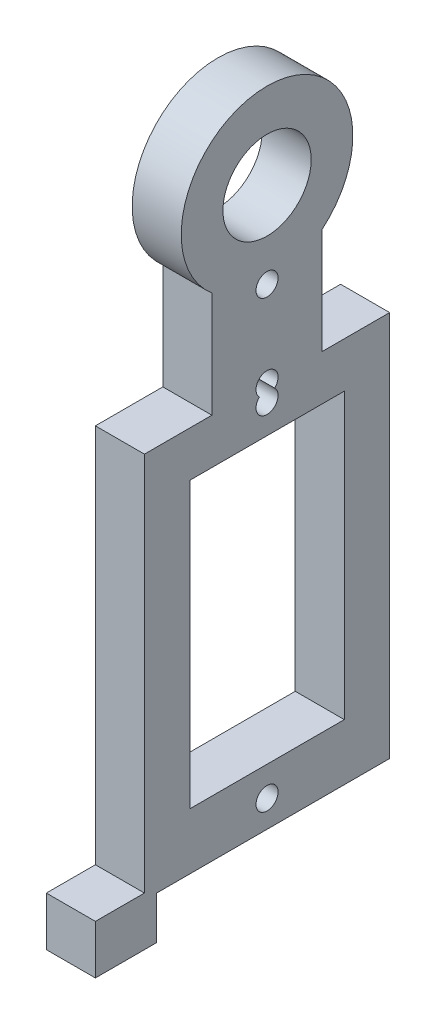
from build123d import *

# Parameters (mm, degrees)
SKETCH1_R            = 7
BOSS_EXTRUDE1_DEPTH  = 4
BOSS_EXTRUDE2_START  = -4.5
SKETCH2_W            = 4
SKETCH2_H            = 34
BOSS_EXTRUDE2_DEPTH  = 9
BOSS_EXTRUDE3_START  = -10
SKETCH3_W            = 4
SKETCH3_H            = 31.5
BOSS_EXTRUDE3_DEPTH  = 20
BOSS_EXTRUDE4_START  = 9
SKETCH4_W            = 4
SKETCH4_H            = 4
BOSS_EXTRUDE4_DEPTH  = 5
BOSS_EXTRUDE5_START  = -1
SKETCH5_R            = 3.6
BOSS_EXTRUDE5_DEPTH  = 6
BOSS_EXTRUDE6_START  = -1
SKETCH6_R            = 0.9
BOSS_EXTRUDE6_DEPTH  = 6
BOSS_EXTRUDE7_START  = -1
SKETCH7_R            = 0.9
BOSS_EXTRUDE7_DEPTH  = 6
BOSS_EXTRUDE8_START  = -6.3
SKETCH8_W            = 6
SKETCH8_H            = 23.2
BOSS_EXTRUDE8_DEPTH  = 12.6
BOSS_EXTRUDE9_START  = -1
SKETCH9_R            = 0.9
BOSS_EXTRUDE9_DEPTH  = 6
BOSS_EXTRUDE10_START = -1
SKETCH10_R           = 0.9
BOSS_EXTRUDE10_DEPTH = 6


with BuildPart() as part:
    # Sketch1 → Boss-Extrude1 (new body)
    with BuildSketch(Plane(origin=(0, 0, 0), x_dir=(0, 0, -1), z_dir=(1, 0, 0))):
        Circle(SKETCH1_R)
    extrude(amount=BOSS_EXTRUDE1_DEPTH)

    # Sketch2 → Boss-Extrude2 (add)
    with BuildSketch(Plane.XY.offset(BOSS_EXTRUDE2_START)):
        with Locations((2, -17)):
            Rectangle(SKETCH2_W, SKETCH2_H)
    extrude(amount=BOSS_EXTRUDE2_DEPTH)

    # Sketch3 → Boss-Extrude3 (add)
    with BuildSketch(Plane.XY.offset(BOSS_EXTRUDE3_START)):
        with Locations((2, -29.75)):
            Rectangle(SKETCH3_W, SKETCH3_H)
    extrude(amount=BOSS_EXTRUDE3_DEPTH)

    # Sketch4 → Boss-Extrude4 (add)
    with BuildSketch(Plane.XY.offset(BOSS_EXTRUDE4_START)):
        with Locations((2, -47)):
            Rectangle(SKETCH4_W, SKETCH4_H)
    extrude(amount=BOSS_EXTRUDE4_DEPTH)


with BuildPart() as body_2:
    # Sketch5 → Boss-Extrude5 (new body)
    with BuildSketch(Plane(origin=(0, 0, 0), x_dir=(0, 0, -1), z_dir=(1, 0, 0)).offset(BOSS_EXTRUDE5_START)):
        Circle(SKETCH5_R)
    extrude(amount=BOSS_EXTRUDE5_DEPTH)


with BuildPart() as part_1:
    add(part.part)

    # Combine1: cut body 2
    add(body_2.part, mode=Mode.SUBTRACT)


with BuildPart() as body_2_2:
    # Sketch6 → Boss-Extrude6 (new body)
    with BuildSketch(Plane(origin=(0, 0, 0), x_dir=(0, 0, -1), z_dir=(1, 0, 0)).offset(BOSS_EXTRUDE6_START)):
        with Locations((0, -7)):
            Circle(SKETCH6_R)
    extrude(amount=BOSS_EXTRUDE6_DEPTH)


with BuildPart() as part_2:
    add(part_1.part)

    # Combine2: cut body 2 2
    add(body_2_2.part, mode=Mode.SUBTRACT)


with BuildPart() as body_2_3:
    # Sketch7 → Boss-Extrude7 (new body)
    with BuildSketch(Plane(origin=(0, 0, 0), x_dir=(0, 0, -1), z_dir=(1, 0, 0)).offset(BOSS_EXTRUDE7_START)):
        with Locations((0, -14)):
            Circle(SKETCH7_R)
    extrude(amount=BOSS_EXTRUDE7_DEPTH)


with BuildPart() as part_3:
    add(part_2.part)

    # Combine3: cut body 2 3
    add(body_2_3.part, mode=Mode.SUBTRACT)


with BuildPart() as body_2_4:
    # Sketch8 → Boss-Extrude8 (new body)
    with BuildSketch(Plane.XY.offset(BOSS_EXTRUDE8_START)):
        with Locations((2, -29.3)):
            Rectangle(SKETCH8_W, SKETCH8_H)
    extrude(amount=BOSS_EXTRUDE8_DEPTH)


with BuildPart() as part_4:
    add(part_3.part)

    # Combine4: cut body 2 4
    add(body_2_4.part, mode=Mode.SUBTRACT)


with BuildPart() as body_2_5:
    # Sketch9 → Boss-Extrude9 (new body)
    with BuildSketch(Plane(origin=(0, 0, 0), x_dir=(0, 0, -1), z_dir=(1, 0, 0)).offset(BOSS_EXTRUDE9_START)):
        with Locations((0, -43.3)):
            Circle(SKETCH9_R)
    extrude(amount=BOSS_EXTRUDE9_DEPTH)


with BuildPart() as part_5:
    add(part_4.part)

    # Combine5: cut body 2 5
    add(body_2_5.part, mode=Mode.SUBTRACT)


with BuildPart() as body_2_6:
    # Sketch10 → Boss-Extrude10 (new body)
    with BuildSketch(Plane(origin=(0, 0, 0), x_dir=(0, 0, -1), z_dir=(1, 0, 0)).offset(BOSS_EXTRUDE10_START)):
        with Locations((0, -15.3)):
            Circle(SKETCH10_R)
    extrude(amount=BOSS_EXTRUDE10_DEPTH)


with BuildPart() as part_6:
    add(part_5.part)

    # Combine6: cut body 2 6
    add(body_2_6.part, mode=Mode.SUBTRACT)


solid = part_6.part
